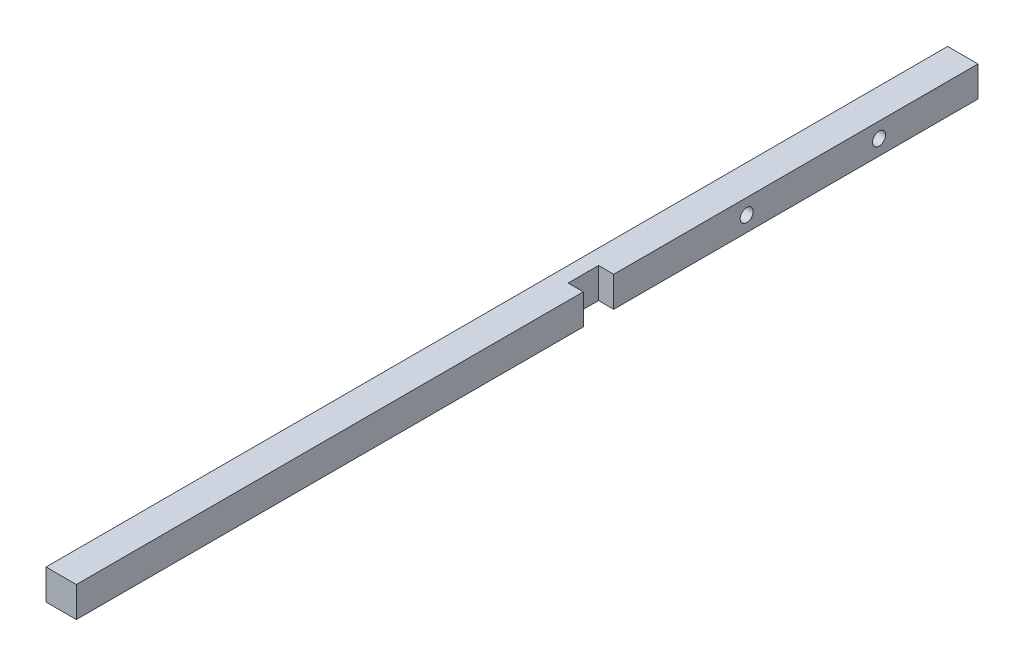
from build123d import *

# Parameters (mm, degrees)
ESQUISSE1_W                  = 10
ESQUISSE1_H                  = 10
BOSS_EXTRU_1_DEPTH           = 307
ENL_V_MAT_EXTRU_1_DEPTH      = 308.081422427
ENL_V_MAT_EXTRU_1_DEPTH_BACK = 308.081422427
ESQUISSE2_W                  = 10
ESQUISSE2_H                  = 10
ESQUISSE3_W                  = 5
ESQUISSE3_H                  = 10
ENL_V_MAT_EXTRU_2_DEPTH      = 308.203515605
D_GAGEMENT_M41_D             = 4.3
TROU_TARAUD_M3X0_51_D        = 2.5
TROU_TARAUD_M3X0_51_DEPTH    = 8.5


with BuildPart() as part:
    # Esquisse1 → Boss.-Extru.1 (new body)
    with BuildSketch(Plane.XY):
        Rectangle(ESQUISSE1_W, ESQUISSE1_H)
    extrude(amount=BOSS_EXTRU_1_DEPTH)

    # Esquisse2 → Enlèv. mat.-Extru.1 (cut, two sides: drawn at the far end of the back side and taken through both)
    with BuildSketch(Plane(origin=(0, 0, 0), x_dir=(1, 0, 0), z_dir=(0, 1, 0)).offset(-ENL_V_MAT_EXTRU_1_DEPTH_BACK)):
        with Locations((0, -5)):
            Rectangle(ESQUISSE2_W, ESQUISSE2_H)
    extrude(amount=ENL_V_MAT_EXTRU_1_DEPTH + ENL_V_MAT_EXTRU_1_DEPTH_BACK, mode=Mode.SUBTRACT)

    # Esquisse3 → Enlèv. mat.-Extru.2 (cut, through all)
    with BuildSketch(Plane.XZ.offset(5)):
        with Locations((2.5, 135)):
            Rectangle(ESQUISSE3_W, ESQUISSE3_H)
    extrude(amount=-ENL_V_MAT_EXTRU_2_DEPTH, mode=Mode.SUBTRACT)

    # Dégagement M41 (through all)
    with Locations(Plane.ZY.offset(5)):
        with Locations((86.186482928, 0), (42.586482928, 0)):
            Hole(D_GAGEMENT_M41_D / 2)

    # Trou taraudé M3x0.51
    with Locations(Plane(origin=(0, 0, 10), x_dir=(-1, 0, 0), z_dir=(0, 0, -1))):
        with Locations((0, 0)):
            Hole(TROU_TARAUD_M3X0_51_D / 2, depth=TROU_TARAUD_M3X0_51_DEPTH)


solid = part.part
